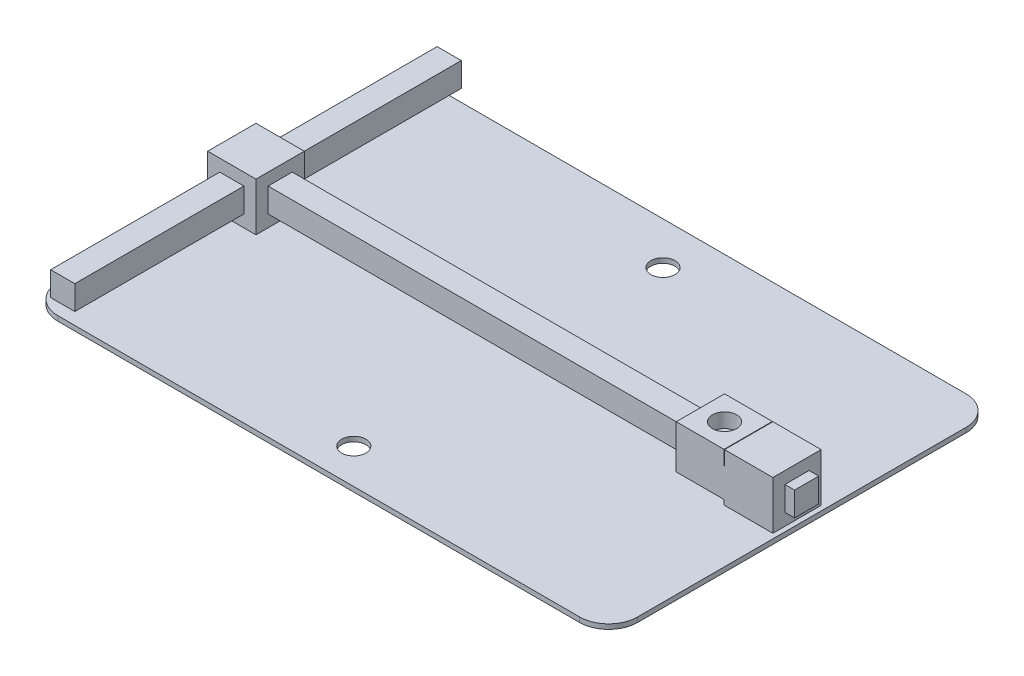
from build123d import *

# Parameters (mm, degrees)
SKETCH1_R                = 2.5
BOSS_EXTRUDE1_DEPTH      = 1
SKETCH2_R                = 3.5
SKETCH2_R_2              = 3
BOSS_EXTRUDE2_DEPTH      = 1.5
SKETCH3_W                = 10
SKETCH3_H                = 10
BOSS_EXTRUDE3_DEPTH      = 10
BOSS_EXTRUDE4_DEPTH      = 35
BOSS_EXTRUDE4_DEPTH_BACK = 45
SKETCH4_W                = 5
SKETCH4_H                = 5
BOSS_EXTRUDE5_DEPTH      = 2
BOSS_EXTRUDE5_DEPTH_BACK = 110
SKETCH5_W                = 5
SKETCH5_H                = 5
CUT_EXTRUDE4_START       = -10
SKETCH6_W                = 9.9
SKETCH6_H                = 10
SKETCH6_R                = 2.5
CUT_EXTRUDE4_DEPTH       = 1
SKETCH6_3_R              = 2.5
SKETCH6_3_W              = 0.1
SKETCH6_3_H              = 10
CUT_EXTRUDE5_DEPTH       = 3


with BuildPart() as part:
    # Sketch1 → Boss-Extrude1 (new body)
    with BuildSketch(Plane(origin=(0, 0, 0), x_dir=(1, 0, 0), z_dir=(0, 1, 0))):
        with BuildLine():
            Line((-54, -40), (54, -40))
            ThreePointArc((54, -40), (58.242640687, -38.242640687), (60, -34))
            Line((60, -34), (60, 34))
            ThreePointArc((60, 34), (58.242640687, 38.242640687), (54, 40))
            Line((54, 40), (-54, 40))
            ThreePointArc((-54, 40), (-58.242640687, 38.242640687), (-60, 34))
            Line((-60, 34), (-60, -34))
            ThreePointArc((-60, -34), (-58.242640687, -38.242640687), (-54, -40))
        make_face()
        with Locations(Location((0, 31.25, 0), (0, 0, 270))):
            Circle(SKETCH1_R, mode=Mode.SUBTRACT)
        with Locations(Location((0, -32.75, 0), (0, 0, 270))):
            Circle(SKETCH1_R, mode=Mode.SUBTRACT)
    extrude(amount=BOSS_EXTRUDE1_DEPTH)

    # Sketch2 → Boss-Extrude2 (add)
    with BuildSketch(Plane.XZ):
        with Locations(Location((-54, 34, 0), (0, 0, 90))):
            Circle(SKETCH2_R)
        with Locations(Location((-54, 0, 0), (0, 0, 90))):
            Circle(SKETCH2_R_2)
        with Locations(Location((-54, -34, 0), (0, 0, 90))):
            Circle(SKETCH2_R)
        with Locations(Location((54, 34, 0), (0, 0, 90))):
            Circle(SKETCH2_R)
        with Locations(Location((54, -34, 0), (0, 0, 90))):
            Circle(SKETCH2_R)
        with Locations(Location((54, 0, 0), (0, 0, 90))):
            Circle(SKETCH2_R_2)
    extrude(amount=BOSS_EXTRUDE2_DEPTH)

    # Sketch3 → Boss-Extrude3 (add)
    with BuildSketch(Plane(origin=(0, 1, 0), x_dir=(1, 0, 0), z_dir=(0, 1, 0))):
        with Locations((54, 0)):
            Rectangle(SKETCH3_W, SKETCH3_H)
        with Locations((44, 0)):
            Rectangle(SKETCH3_W, SKETCH3_H)
        with Locations((-53, 0)):
            Rectangle(SKETCH3_W, SKETCH3_H)
    extrude(amount=BOSS_EXTRUDE3_DEPTH)

    # Sketch4 → Boss-Extrude4 (add, two sides: drawn at the far end of the back side and taken through both)
    with BuildSketch(Plane.XY.offset(5).offset(-BOSS_EXTRUDE4_DEPTH_BACK)):
        with Locations((-53, 6)):
            Rectangle(SKETCH4_W, SKETCH4_H)
    extrude(amount=BOSS_EXTRUDE4_DEPTH + BOSS_EXTRUDE4_DEPTH_BACK)

    # Sketch5 → Boss-Extrude5 (add, two sides: drawn at the far end of the back side and taken through both)
    with BuildSketch(Plane(origin=(59, 0, 0), x_dir=(0, 0, -1), z_dir=(1, 0, 0)).offset(-BOSS_EXTRUDE5_DEPTH_BACK)):
        with Locations((0, 6)):
            Rectangle(SKETCH5_W, SKETCH5_H)
    extrude(amount=BOSS_EXTRUDE5_DEPTH + BOSS_EXTRUDE5_DEPTH_BACK)

    # Sketch6 → Cut-Extrude4 (cut)
    # profile 1 of 2: a face of its own
    with BuildSketch(Plane(origin=(0, 11, 0), x_dir=(1, 0, 0), z_dir=(0, 1, 0)).offset(CUT_EXTRUDE4_START)):
        with Locations((43.95, 0)):
            Rectangle(SKETCH6_W, SKETCH6_H)
        with Locations((44, 0)):
            Circle(SKETCH6_R, mode=Mode.SUBTRACT)
    # profile 2 of 2: a face of its own
    with BuildSketch(Plane(origin=(0, 11, 0), x_dir=(1, 0, 0), z_dir=(0, 1, 0)).offset(CUT_EXTRUDE4_START)):
        with Locations((44, 0)):
            Circle(SKETCH6_R)
    extrude(amount=CUT_EXTRUDE4_DEPTH, mode=Mode.SUBTRACT)

    # Sketch6<3> → Cut-Extrude5 (cut)
    with BuildSketch(Plane(origin=(0, 11, 0), x_dir=(1, 0, 0), z_dir=(0, 1, 0))):
        with Locations(Location((44, 0, 0), (0, 0, 270))):
            Circle(SKETCH6_3_R)
        with Locations((48.95, 0)):
            Rectangle(SKETCH6_3_W, SKETCH6_3_H)
    extrude(amount=-CUT_EXTRUDE5_DEPTH, mode=Mode.SUBTRACT)


solid = part.part
